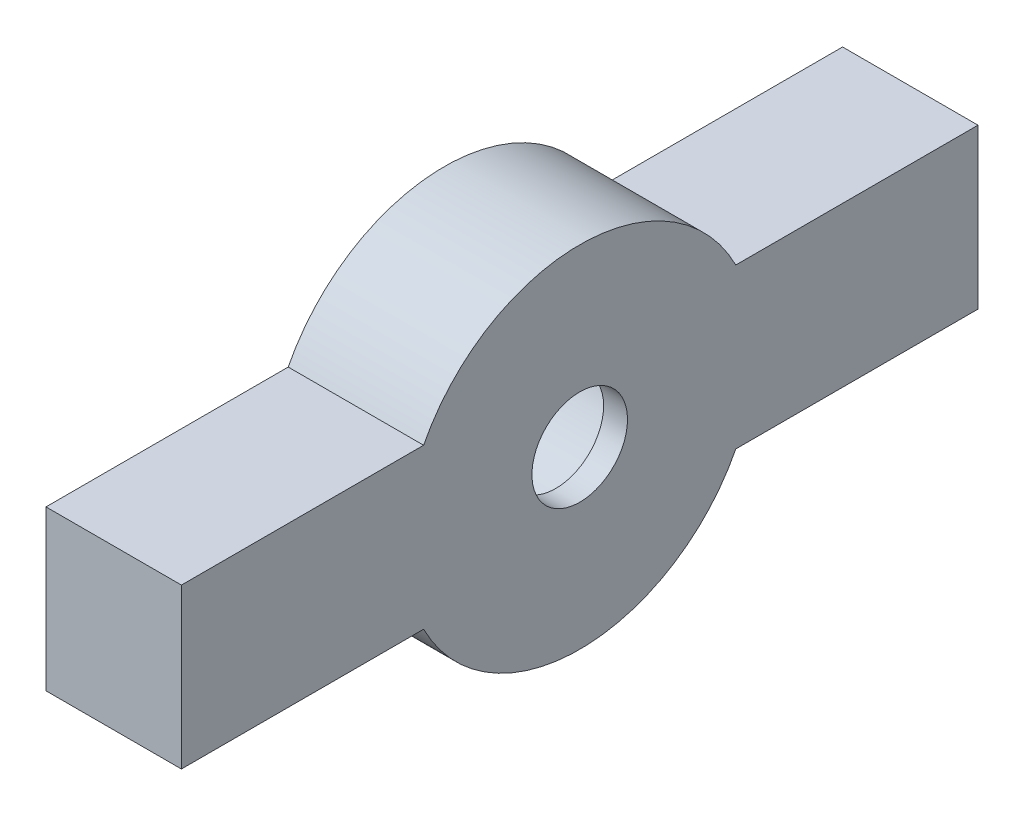
from build123d import *

# Parameters (mm, degrees)
EXTRUDE_1_DEPTH = 3.4
EXTRUDE_START   = -0.6
SKETCH_2_R      = 2.4
SKETCH_2_R_2    = 1.2
EXTRUDE_2_DEPTH = 0.6
CHAMFER_1_SIZE  = 0.2


with BuildPart() as part:
    # 草图1 → 凸台-拉伸1 (new body)
    with BuildSketch(Plane(origin=(0, 0, 0), x_dir=(0, 0, -1), z_dir=(1, 0, 0))):
        with BuildLine():
            Line((1.326649916, 2), (3.919183588, 2))
            ThreePointArc((3.919183588, 2), (0, 4.4), (-3.919183588, 2))
            Line((-3.919183588, 2), (-1.326649916, 2))
            ThreePointArc((-1.326649916, 2), (0, 2.4), (1.326649916, 2))
        make_face()
        with BuildLine():
            ThreePointArc((4.4, 0), (4.278107513, 1.028492151), (3.919183588, 2))
            Line((3.919183588, 2), (1.326649916, 2))
            ThreePointArc((1.326649916, 2), (2.114705629, 1.134909732), (2.4, 0))
            ThreePointArc((2.4, 0), (2.114705629, -1.134909732), (1.326649916, -2))
            Line((1.326649916, -2), (3.919183588, -2))
            ThreePointArc((3.919183588, -2), (4.278107513, -1.028492151), (4.4, 0))
        make_face()
        with BuildLine():
            Line((-1.326649916, 2), (-3.919183588, 2))
            ThreePointArc((-3.919183588, 2), (-4.4, 0), (-3.919183588, -2))
            Line((-3.919183588, -2), (-1.326649916, -2))
            ThreePointArc((-1.326649916, -2), (-2.4, 0), (-1.326649916, 2))
        make_face()
        with BuildLine():
            ThreePointArc((-3.919183588, -2), (-4.4, 0), (-3.919183588, 2))
            Line((-3.919183588, 2), (-10, 2))
            Line((-10, 2), (-10, -2))
            Line((-10, -2), (-3.919183588, -2))
        make_face()
        with BuildLine():
            Line((10, -2), (10, 2))
            Line((10, 2), (3.919183588, 2))
            ThreePointArc((3.919183588, 2), (4.278107513, 1.028492151), (4.4, 0))
            ThreePointArc((4.4, 0), (4.278107513, -1.028492151), (3.919183588, -2))
            Line((3.919183588, -2), (10, -2))
        make_face()
        with BuildLine():
            ThreePointArc((-3.919183588, -2), (0, -4.4), (3.919183588, -2))
            Line((3.919183588, -2), (1.326649916, -2))
            ThreePointArc((1.326649916, -2), (0, -2.4), (-1.326649916, -2))
            Line((-1.326649916, -2), (-3.919183588, -2))
        make_face()
    extrude(amount=EXTRUDE_1_DEPTH)

    # 草图2 → 凸台-拉伸2 (add)
    with BuildSketch(Plane(origin=(3.4, 0, 0), x_dir=(0, 0, -1), z_dir=(1, 0, 0)).offset(EXTRUDE_START)):
        Circle(SKETCH_2_R)
        Circle(SKETCH_2_R_2, mode=Mode.SUBTRACT)
    extrude(amount=EXTRUDE_2_DEPTH)

    # 倒角1
    chamfer_1_edges = [part.edges().sort_by_distance(p)[0] for p in [
        (0, 2, 1.326649916),
    ]]
    chamfer(chamfer_1_edges, length=CHAMFER_1_SIZE)


solid = part.part
